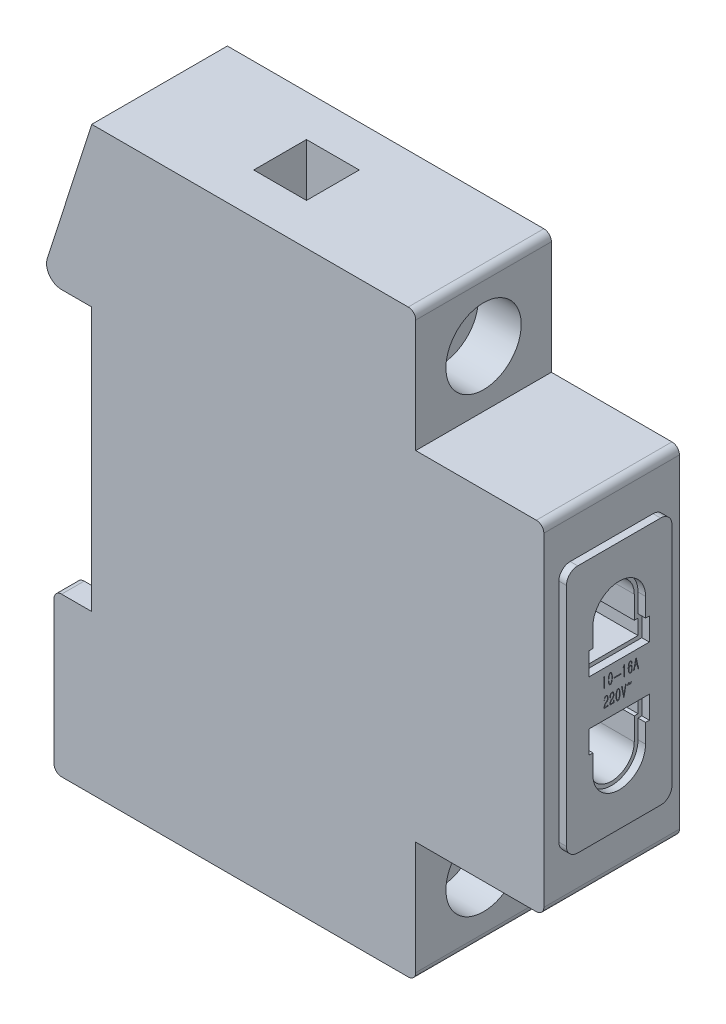
from build123d import *

# Parameters (mm, degrees)
EXTRUDE_1_DEPTH           = 9
EXTRUDE_2_DEPTH           = 1
CUT_EXTRUDE_1_DEPTH       = 1
CUT_EXTRUDE_2_DEPTH       = 10
HOLE_WIZARD_1_D           = 5.5
HOLE_WIZARD_1_DEPTH       = 7.5
HOLE_WIZARD_1_CBORE_D     = 10
HOLE_WIZARD_1_CBORE_DEPTH = 5.7
HOLE_WIZARD_1_TIP         = 1.652366702
CUT_EXTRUDE_3_REACH       = 103.814
SKETCH_6_W                = 8
SKETCH_6_H                = 12
SKETCH_7_R                = 3
SKETCH_7_W                = 5
SKETCH_7_H                = 7
SKETCH_7_H_2              = 8
CUT_EXTRUDE_4_DEPTH       = 10
SKETCH_8_W                = 7
SKETCH_8_H                = 7
CUT_EXTRUDE_5_DEPTH       = 10
SKETCH_9_W                = 7
SKETCH_9_H                = 7
CUT_EXTRUDE_6_DEPTH       = 10
SKETCH_1016A_W            = 0.927551673
SKETCH_1016A_H            = 0.093010868
CUT_EXTRUDE_7_DEPTH       = 0.25
CUT_EXTRUDE_8_DEPTH       = 0.25


with BuildPart() as part:
    # Sketch 221 → 凸台-拉伸1 (new, symmetric)
    with BuildSketch(Plane.XY):
        with BuildLine():
            Line((0, 1), (0, 20))
            ThreePointArc((0, 20), (0.292893219, 20.707106781), (1, 21))
            Line((1, 21), (5, 21))
            Line((5, 21), (5, 56))
            Line((5, 56), (1, 56))
            ThreePointArc((1, 56), (-0.615989127, 56.82162012), (-0.904249074, 58.611420858))
            Line((-0.904249074, 58.611420858), (5, 77))
            Line((5, 77), (47, 77))
            ThreePointArc((47, 77), (47.707106781, 76.707106781), (48, 76))
            Line((48, 76), (48, 61))
            Line((48, 61), (64, 61))
            ThreePointArc((64, 61), (64.707106781, 60.707106781), (65, 60))
            Line((65, 60), (65, 17))
            ThreePointArc((65, 17), (64.707106781, 16.292893219), (64, 16))
            Line((64, 16), (48, 16))
            Line((48, 16), (48, 1))
            ThreePointArc((48, 1), (47.707106781, 0.292893219), (47, 0))
            Line((47, 0), (1, 0))
            ThreePointArc((1, 0), (0.292893219, 0.292893219), (0, 1))
        make_face()
    extrude(amount=EXTRUDE_1_DEPTH, both=True)

    # 草图2 → 凸台-拉伸2 (add)
    with BuildSketch(Plane(origin=(65, 0, 0), x_dir=(0, 0, -1), z_dir=(1, 0, 0))):
        with BuildLine():
            Line((-5.5, 55), (5.5, 55))
            ThreePointArc((5.5, 55), (6.560660172, 54.560660172), (7, 53.5))
            Line((7, 53.5), (7, 23.5))
            ThreePointArc((7, 23.5), (6.560660172, 22.439339828), (5.5, 22))
            Line((5.5, 22), (-5.5, 22))
            ThreePointArc((-5.5, 22), (-6.560660172, 22.439339828), (-7, 23.5))
            Line((-7, 23.5), (-7, 53.5))
            ThreePointArc((-7, 53.5), (-6.560660172, 54.560660172), (-5.5, 55))
        make_face()
    extrude(amount=EXTRUDE_2_DEPTH)

    # 2P插孔 → 切除-拉伸1 (cut)
    with BuildSketch(Plane(origin=(66, 0, 0), x_dir=(0, 0, -1), z_dir=(1, 0, 0))):
        with BuildLine():
            Line((-3.5, 46.992069107), (-3.5, 44.492069107))
            Line((-3.5, 44.492069107), (-4, 44.492069107))
            Line((-4, 44.492069107), (-4, 41.492069107))
            Line((-4, 41.492069107), (4, 41.492069107))
            Line((4, 41.492069107), (4, 44.492069107))
            Line((4, 44.492069107), (3.5, 44.492069107))
            Line((3.5, 44.492069107), (3.5, 46.992069107))
            ThreePointArc((3.5, 46.992069107), (0, 50.492069107), (-3.5, 46.992069107))
        make_face()
        with BuildLine():
            Line((3.5, 32.507930893), (4, 32.507930893))
            Line((4, 32.507930893), (4, 35.507930893))
            Line((4, 35.507930893), (-4, 35.507930893))
            Line((-4, 35.507930893), (-4, 32.507930893))
            Line((-4, 32.507930893), (-3.5, 32.507930893))
            Line((-3.5, 32.507930893), (-3.5, 30.007930893))
            ThreePointArc((-3.5, 30.007930893), (0, 26.507930893), (3.5, 30.007930893))
            Line((3.5, 30.007930893), (3.5, 32.507930893))
        make_face()
    extrude(amount=-CUT_EXTRUDE_1_DEPTH, mode=Mode.SUBTRACT)

    # 2P插孔<3> → 切除-拉伸2 (cut)
    with BuildSketch(Plane(origin=(66, 0, 0), x_dir=(0, 0, -1), z_dir=(1, 0, 0))):
        with BuildLine():
            Line((-3, 46.992069107), (-3, 43.992069107))
            Line((-3, 43.992069107), (-3.5, 43.992069107))
            Line((-3.5, 43.992069107), (-3.5, 41.992069107))
            Line((-3.5, 41.992069107), (3.5, 41.992069107))
            Line((3.5, 41.992069107), (3.5, 43.992069107))
            Line((3.5, 43.992069107), (3, 43.992069107))
            Line((3, 43.992069107), (3, 46.992069107))
            ThreePointArc((3, 46.992069107), (0, 49.992069107), (-3, 46.992069107))
        make_face()
        with BuildLine():
            Line((3, 33.007930893), (3.5, 33.007930893))
            Line((3.5, 33.007930893), (3.5, 35.007930893))
            Line((3.5, 35.007930893), (-3.5, 35.007930893))
            Line((-3.5, 35.007930893), (-3.5, 33.007930893))
            Line((-3.5, 33.007930893), (-3, 33.007930893))
            Line((-3, 33.007930893), (-3, 30.007930893))
            ThreePointArc((-3, 30.007930893), (0, 27.007930893), (3, 30.007930893))
            Line((3, 30.007930893), (3, 33.007930893))
        make_face()
    extrude(amount=-CUT_EXTRUDE_2_DEPTH, mode=Mode.SUBTRACT)

    # 打孔尺寸(%根据)开槽圆柱头螺钉的类型1
    with Locations(Plane(origin=(48, 0, 0), x_dir=(0, 0, -1), z_dir=(1, 0, 0))):
        with Locations((0, 68.5), (0, 8.5)):
            CounterBoreHole(HOLE_WIZARD_1_D / 2, HOLE_WIZARD_1_CBORE_D / 2, HOLE_WIZARD_1_CBORE_DEPTH, depth=HOLE_WIZARD_1_DEPTH)
            with Locations((0, 0, -(HOLE_WIZARD_1_DEPTH + HOLE_WIZARD_1_TIP / 2))):  # 118° drill point
                Cone(0, HOLE_WIZARD_1_D / 2, HOLE_WIZARD_1_TIP, mode=Mode.SUBTRACT)

    # 切除-拉伸3: up to this face of the body (flat: up to its plane)
    cut_extrude_3_end = Plane(part.part.faces().sort_by_distance((3, 21, 0))[0])
    # 草图6 → 切除-拉伸3 (cut, up to the picked face)
    with BuildSketch(Plane.XZ, mode=Mode.PRIVATE) as cut_extrude_3_sk1:
        with Locations((1, 0)):
            Rectangle(SKETCH_6_W, SKETCH_6_H)
    cut_extrude_3_tool1 = split(extrude(cut_extrude_3_sk1.sketch, amount=-CUT_EXTRUDE_3_REACH, mode=Mode.PRIVATE), bisect_by=cut_extrude_3_end, keep=Keep.BOTH, mode=Mode.PRIVATE)
    add(cut_extrude_3_tool1.solids().sort_by(Axis((1, 0, 0), (0, 1, 0)))[0], mode=Mode.SUBTRACT)

    # 草图7 → 切除-拉伸4 (cut)
    with BuildSketch(Plane.ZY.offset(-5)):
        with Locations(Location((0, 38.5, 0), (0, 0, 270))):
            Circle(SKETCH_7_R)
        with Locations((0, 46)):
            Rectangle(SKETCH_7_W, SKETCH_7_H)
        with Locations((0, 30.5)):
            Rectangle(SKETCH_7_W, SKETCH_7_H_2)
    extrude(amount=-CUT_EXTRUDE_4_DEPTH, mode=Mode.SUBTRACT)

    # 草图8 → 切除-拉伸5 (cut)
    with BuildSketch(Plane(origin=(0, 77, 0), x_dir=(1, 0, 0), z_dir=(0, 1, 0))):
        with Locations((24.5, 0)):
            Rectangle(SKETCH_8_W, SKETCH_8_H)
    extrude(amount=-CUT_EXTRUDE_5_DEPTH, mode=Mode.SUBTRACT)

    # 草图9 → 切除-拉伸6 (cut)
    with BuildSketch(Plane.XZ):
        with Locations((24.5, 0)):
            Rectangle(SKETCH_9_W, SKETCH_9_H)
    extrude(amount=-CUT_EXTRUDE_6_DEPTH, mode=Mode.SUBTRACT)

    # 文字1016A → 切除-拉伸7 (cut)
    # profile 1 of 6: a face of its own
    with BuildSketch(Plane(origin=(66, 0, 0), x_dir=(0, 0, -1), z_dir=(1, 0, 0))):
        with BuildLine():
            Line((-1.957775378, 40.5744709), (-1.93412313, 40.5744709))
            Line((-1.93412313, 40.5744709), (-1.936360505, 39.428615371))
            add(Edge.make_bspline(
                [(-1.936360505, 39.428615371), (-1.936615384, 39.418281532), (-1.937104086, 39.398467548), (-1.937143748, 39.370118875), (-1.938076067, 39.344451781), (-1.938150326, 39.321429518), (-1.938843584, 39.301082161), (-1.93964527, 39.283405455), (-1.939721445, 39.268366262), (-1.941139484, 39.244827985), (-1.942829265, 39.21246461), (-1.947019834, 39.179130883), (-1.950355843, 39.155379208), (-1.95374717, 39.14456703), (-1.958043634, 39.136012081), (-1.962331497, 39.137009746), (-1.964167877, 39.13743702)],
                knots=[0, 0, 0, 0, 1.45038606, 2.780953852, 3.977268029, 5.053718292, 6.010937745, 6.833690271, 7.536464333, 8.120251454, 10.142880859, 12.069479857, 12.873132744, 13.440417135, 13.76034519, 14, 14, 14, 14], degree=3))
            add(Edge.make_bspline(
                [(-1.964167877, 39.13743702), (-1.96459239, 39.137758347), (-1.966409407, 39.139133704), (-1.97074249, 39.14204483), (-1.975891086, 39.149848276), (-1.97814482, 39.156849015), (-1.979509876, 39.161089268)],
                knots=[0, 0, 0, 0, 0.221265066, 0.947068446, 2.150880552, 4, 4, 4, 4], degree=3))
            Line((-1.979509876, 39.161089268), (-1.9900575, 39.189216266))
            Line((-1.9900575, 39.189216266), (-2.014029373, 39.266885134))
            add(Edge.make_bspline(
                [(-2.014029373, 39.266885134), (-2.01691507, 39.274192974), (-2.021941804, 39.286922855), (-2.027012669, 39.303670781), (-2.030859599, 39.314365039), (-2.031882082, 39.3230332), (-2.026956777, 39.331163958), (-2.023329459, 39.343682847), (-2.017747986, 39.359662385), (-2.012477164, 39.378522569), (-2.007821784, 39.398900701), (-2.003628099, 39.420918631), (-2.001251418, 39.445725517), (-2.000085563, 39.469410885), (-1.999190839, 39.492214928), (-1.999028281, 39.514168869), (-1.998579925, 39.540163008), (-1.998649967, 39.558915529), (-1.998687374, 39.568930734)],
                knots=[0, 0, 0, 0, 1.220359697, 2.125803599, 2.712350858, 2.994193817, 3.439826662, 4.12562012, 5.031064022, 6.063176816, 7.167225426, 8.277459231, 9.542238136, 11.034069985, 11.961482632, 13.08703073, 14.444263491, 16, 16, 16, 16], degree=3))
            Line((-1.998687374, 39.568930734), (-1.996769625, 40.414658413))
            Line((-1.996769625, 40.414658413), (-2.10895799, 40.317492421))
            Line((-2.10895799, 40.317492421), (-2.117587864, 40.354249293))
            add(Edge.make_bspline(
                [(-2.117587864, 40.354249293), (-2.108468534, 40.363672344), (-2.091373972, 40.381336242), (-2.068528059, 40.406769081), (-2.049738096, 40.428840756), (-2.030167095, 40.454643578), (-2.008255127, 40.48675503), (-1.99207383, 40.513137021), (-1.983665001, 40.526846779)],
                knots=[0, 0, 0, 0, 1.077185482, 2.019228619, 2.808185376, 3.45765616, 4.678836699, 6, 6, 6, 6], degree=3))
            Line((-1.983665001, 40.526846779), (-1.957775378, 40.5744709))
        make_face()
    # profile 2 of 6: a face of its own
    with BuildSketch(Plane(origin=(66, 0, 0), x_dir=(0, 0, -1), z_dir=(1, 0, 0))):
        with BuildLine():
            add(Edge.make_bspline(
                [(-1.443818421, 39.901340706), (-1.442776824, 39.922017987), (-1.440642789, 39.964381861), (-1.434841438, 40.029315671), (-1.426284257, 40.097056697), (-1.41636119, 40.166625401), (-1.402630338, 40.23534955), (-1.385057418, 40.300705646), (-1.362624183, 40.361133003), (-1.340239323, 40.407533474), (-1.321316181, 40.441553724), (-1.307547787, 40.464184813), (-1.294449079, 40.484594199), (-1.281543845, 40.50232618), (-1.268877316, 40.517425374), (-1.257195562, 40.530517655), (-1.24540608, 40.540710626), (-1.230620362, 40.550817891), (-1.212622957, 40.559832499), (-1.191767332, 40.567718641), (-1.17169966, 40.572280523), (-1.158626561, 40.572248819), (-1.152320445, 40.572233525)],
                knots=[0, 0, 0, 0, 1.583211401, 3.243703523, 4.983978234, 6.804605119, 8.6166428, 10.340282122, 11.974804003, 13.53820457, 14.274983449, 14.951299633, 15.563740824, 16.129235462, 16.626851747, 17.070813204, 17.469389546, 17.815167281, 18.438300608, 19.002855301, 19.519003895, 20, 20, 20, 20], degree=3))
            add(Edge.make_bspline(
                [(-1.152320445, 40.572233525), (-1.146290365, 40.571179096), (-1.133553898, 40.568951979), (-1.114724202, 40.560671122), (-1.094739192, 40.549658511), (-1.073476188, 40.53538519), (-1.052247101, 40.516193938), (-1.032572804, 40.490775678), (-1.014307672, 40.459732815), (-0.991609414, 40.410602698), (-0.966596702, 40.344010166), (-0.946956844, 40.274088965), (-0.934199405, 40.215708015), (-0.925879513, 40.169129451), (-0.919263868, 40.119737588), (-0.912159714, 40.050302233), (-0.905824114, 39.961327559), (-0.904803009, 39.889633305), (-0.904291466, 39.853716585)],
                knots=[0, 0, 0, 0, 0.36369769, 0.768186139, 1.217229854, 1.724510149, 2.290946358, 2.914777825, 3.632489608, 4.433551378, 6.137860108, 7.866765886, 8.757390638, 9.699141408, 10.686159515, 11.726895222, 13.859299765, 16, 16, 16, 16], degree=3))
            add(Edge.make_bspline(
                [(-0.904291466, 39.853716585), (-0.906248127, 39.824936911), (-0.910269473, 39.765788678), (-0.919836026, 39.67520078), (-0.935613892, 39.580961348), (-0.955468336, 39.501578219), (-0.974672524, 39.438372265), (-0.99095834, 39.392763441), (-1.00918037, 39.349692435), (-1.02862894, 39.309576657), (-1.04886152, 39.273866276), (-1.069805297, 39.243859214), (-1.091936524, 39.22074774), (-1.114673456, 39.204146754), (-1.136873151, 39.192896509), (-1.158084851, 39.185703259), (-1.178284829, 39.181710472), (-1.19140899, 39.182462752), (-1.197707191, 39.182823766)],
                knots=[0, 0, 0, 0, 1.760488992, 3.618172134, 5.557361062, 7.587083219, 8.607294374, 9.588398617, 10.541277716, 11.460251193, 12.307925722, 13.044175775, 13.687957546, 14.251129358, 14.754223989, 15.200440537, 15.616296545, 16, 16, 16, 16], degree=3))
            add(Edge.make_bspline(
                [(-1.197707191, 39.182823766), (-1.203725297, 39.183669704), (-1.216404983, 39.18545203), (-1.235517718, 39.192952267), (-1.255421101, 39.204508112), (-1.276669332, 39.219741092), (-1.298065126, 39.240668922), (-1.318668015, 39.267737628), (-1.338425909, 39.301094294), (-1.357202453, 39.340102578), (-1.374838207, 39.383551168), (-1.390280532, 39.430432866), (-1.40458754, 39.47969773), (-1.416051307, 39.531206735), (-1.425484774, 39.583264884), (-1.432886447, 39.634435682), (-1.438079905, 39.684120497), (-1.440882679, 39.732121162), (-1.441862736, 39.778070749), (-1.442898516, 39.821537976), (-1.443546489, 39.862344751), (-1.443730008, 39.888662078), (-1.443818421, 39.901340706)],
                knots=[0, 0, 0, 0, 0.451175502, 0.950591959, 1.515271951, 2.162531354, 2.891688268, 3.734081857, 4.687580886, 5.773002708, 6.954198864, 8.17563603, 9.445923076, 10.771603705, 12.101713585, 13.383756751, 14.619631726, 15.819374781, 16.961914306, 18.040825747, 19.056148764, 20, 20, 20, 20], degree=3))
        make_face()
        with BuildLine():
            add(Edge.make_bspline(
                [(-1.387564425, 39.896865957), (-1.387791887, 39.886531892), (-1.388274908, 39.864587302), (-1.388734275, 39.829635981), (-1.387877294, 39.790744587), (-1.386412995, 39.733354351), (-1.381036988, 39.658352514), (-1.367296895, 39.56830935), (-1.347673413, 39.481109699), (-1.326050109, 39.412778577), (-1.305918979, 39.364067913), (-1.290471211, 39.333836319), (-1.2742196, 39.309413314), (-1.257192836, 39.290810113), (-1.23996984, 39.27762632), (-1.223874314, 39.268205463), (-1.208621801, 39.261736405), (-1.198399808, 39.26089274), (-1.193552066, 39.260492635)],
                knots=[0, 0, 0, 0, 0.705717407, 1.498604912, 2.386138873, 3.361274458, 5.418191474, 7.514713171, 9.57394393, 11.515405308, 12.398906158, 13.169972934, 13.829695216, 14.395845116, 14.883250105, 15.303691084, 15.669778158, 16, 16, 16, 16], degree=3))
            add(Edge.make_bspline(
                [(-1.193552066, 39.260492635), (-1.189064147, 39.260550358), (-1.179424155, 39.260674346), (-1.164341937, 39.26430136), (-1.148486091, 39.271936345), (-1.130898397, 39.281969382), (-1.112830148, 39.297410495), (-1.094996464, 39.318512538), (-1.077516764, 39.34555724), (-1.060084034, 39.377536742), (-1.043593937, 39.413115804), (-1.028822279, 39.450810558), (-1.015966979, 39.489722069), (-1.002063862, 39.544161905), (-0.987770787, 39.614768269), (-0.97493234, 39.700990174), (-0.966418312, 39.786017292), (-0.962872667, 39.855383159), (-0.961886404, 39.910290221), (-0.962706046, 39.953982993), (-0.964252486, 40.000869948), (-0.966023175, 40.033242033), (-0.96693796, 40.049966319)],
                knots=[0, 0, 0, 0, 0.308126263, 0.661851094, 1.055455993, 1.515432549, 2.051181639, 2.679899785, 3.409545513, 4.262246801, 5.183512362, 6.104777924, 7.045624675, 8.000099589, 9.967578284, 11.997814557, 13.993544283, 15.842664909, 16.77344086, 17.770161498, 18.848005724, 20, 20, 20, 20], degree=3))
            add(Edge.make_bspline(
                [(-0.96693796, 40.049966319), (-0.968479455, 40.065633571), (-0.971471474, 40.096043483), (-0.976731669, 40.139992941), (-0.983259002, 40.180782156), (-0.992456493, 40.231033616), (-1.007303655, 40.291330324), (-1.027754572, 40.348734611), (-1.045393249, 40.392075392), (-1.060554195, 40.419535868), (-1.075974074, 40.44284021), (-1.093109438, 40.46062436), (-1.109788763, 40.474482895), (-1.12548712, 40.484840805), (-1.140149441, 40.492153986), (-1.150022956, 40.493805927), (-1.15455782, 40.494564657)],
                knots=[0, 0, 0, 0, 1.302834758, 2.528783491, 3.662347304, 4.720685654, 6.75648594, 8.792057095, 9.759925264, 10.624039914, 11.384659521, 12.06448684, 12.659424566, 13.175428451, 13.621277708, 14, 14, 14, 14], degree=3))
            add(Edge.make_bspline(
                [(-1.15455782, 40.494564657), (-1.15948745, 40.494205933), (-1.169846357, 40.493452128), (-1.185660167, 40.488604913), (-1.202444575, 40.48102547), (-1.220884564, 40.470511897), (-1.240093756, 40.453637742), (-1.259489911, 40.428937467), (-1.279559882, 40.39617419), (-1.300507559, 40.35584263), (-1.320522514, 40.308324061), (-1.337527814, 40.253895813), (-1.352222634, 40.193478666), (-1.363291134, 40.128776017), (-1.372232264, 40.06401917), (-1.379203843, 40.003151213), (-1.384544736, 39.948069221), (-1.386596374, 39.913280691), (-1.387564425, 39.896865957)],
                knots=[0, 0, 0, 0, 0.347392606, 0.729995465, 1.156884588, 1.644891073, 2.219813456, 2.945627096, 3.849684979, 4.924243867, 6.145708801, 7.477723151, 8.938118981, 10.524254447, 12.100980159, 13.544449593, 14.841364989, 16, 16, 16, 16], degree=3))
        make_face(mode=Mode.SUBTRACT)
    # profile 3 of 6: a face of its own
    with BuildSketch(Plane(origin=(66, 0, 0), x_dir=(0, 0, -1), z_dir=(1, 0, 0))):
        with Locations((-0.24778177, 39.716757284)):
            Rectangle(SKETCH_1016A_W, SKETCH_1016A_H)
    # profile 4 of 6: a face of its own
    with BuildSketch(Plane(origin=(66, 0, 0), x_dir=(0, 0, -1), z_dir=(1, 0, 0))):
        with BuildLine():
            Line((0.681048402, 40.5744709), (0.70470065, 40.5744709))
            Line((0.70470065, 40.5744709), (0.702463276, 39.428615371))
            add(Edge.make_bspline(
                [(0.702463276, 39.428615371), (0.702208397, 39.418281532), (0.701719695, 39.398467548), (0.701680032, 39.370118875), (0.700747713, 39.344451781), (0.700673454, 39.321429518), (0.699980196, 39.301082161), (0.69917851, 39.283405455), (0.699102335, 39.268366262), (0.697684296, 39.244827985), (0.695994515, 39.21246461), (0.691803946, 39.179130883), (0.688467937, 39.155379208), (0.68507661, 39.14456703), (0.680780146, 39.136012081), (0.676492283, 39.137009746), (0.674655903, 39.13743702)],
                knots=[0, 0, 0, 0, 1.45038606, 2.780953852, 3.977268029, 5.053718292, 6.010937745, 6.833690271, 7.536464333, 8.120251454, 10.142880859, 12.069479857, 12.873132744, 13.440417135, 13.76034519, 14, 14, 14, 14], degree=3))
            add(Edge.make_bspline(
                [(0.674655903, 39.13743702), (0.67423139, 39.137758347), (0.672414373, 39.139133704), (0.66808129, 39.14204483), (0.662932694, 39.149848276), (0.66067896, 39.156849015), (0.659313904, 39.161089268)],
                knots=[0, 0, 0, 0, 0.221265066, 0.947068446, 2.150880552, 4, 4, 4, 4], degree=3))
            Line((0.659313904, 39.161089268), (0.64876628, 39.189216266))
            Line((0.64876628, 39.189216266), (0.624794407, 39.266885134))
            add(Edge.make_bspline(
                [(0.624794407, 39.266885134), (0.621908711, 39.274192974), (0.616881976, 39.286922855), (0.611811111, 39.303670781), (0.607964181, 39.314365039), (0.606941698, 39.3230332), (0.611867003, 39.331163958), (0.615494321, 39.343682847), (0.621075794, 39.359662385), (0.626346616, 39.378522569), (0.631001996, 39.398900701), (0.635195681, 39.420918631), (0.637572362, 39.445725517), (0.638738217, 39.469410885), (0.639632941, 39.492214928), (0.639795499, 39.514168869), (0.640243855, 39.540163008), (0.640173813, 39.558915529), (0.640136406, 39.568930734)],
                knots=[0, 0, 0, 0, 1.220359697, 2.125803599, 2.712350858, 2.994193817, 3.439826662, 4.12562012, 5.031064022, 6.063176816, 7.167225426, 8.277459231, 9.542238136, 11.034069985, 11.961482632, 13.08703073, 14.444263491, 16, 16, 16, 16], degree=3))
            Line((0.640136406, 39.568930734), (0.642054156, 40.414658413))
            Line((0.642054156, 40.414658413), (0.52986579, 40.317492421))
            Line((0.52986579, 40.317492421), (0.521235916, 40.354249293))
            add(Edge.make_bspline(
                [(0.521235916, 40.354249293), (0.530355247, 40.363672344), (0.547449808, 40.381336242), (0.570295721, 40.406769081), (0.589085684, 40.428840756), (0.608656685, 40.454643578), (0.630568653, 40.48675503), (0.64674995, 40.513137021), (0.655158779, 40.526846779)],
                knots=[0, 0, 0, 0, 1.077185482, 2.019228619, 2.808185376, 3.45765616, 4.678836699, 6, 6, 6, 6], degree=3))
            Line((0.655158779, 40.526846779), (0.681048402, 40.5744709))
        make_face()
    # profile 5 of 6: a face of its own
    with BuildSketch(Plane(origin=(66, 0, 0), x_dir=(0, 0, -1), z_dir=(1, 0, 0))):
        with BuildLine():
            Line((1.704167942, 40.164392059), (1.674123195, 40.164392059))
            add(Edge.make_bspline(
                [(1.674123195, 40.164392059), (1.672069661, 40.177266363), (1.668006635, 40.202738867), (1.66426445, 40.241663294), (1.659700671, 40.282109433), (1.651886667, 40.324905069), (1.639592271, 40.369397915), (1.622299198, 40.404769152), (1.605939935, 40.43127281), (1.59199346, 40.44899653), (1.57599338, 40.463842832), (1.558891993, 40.476341326), (1.540476048, 40.486004368), (1.521168623, 40.492977042), (1.500678069, 40.496096551), (1.479822274, 40.495900047), (1.459515853, 40.493535065), (1.440653876, 40.488616988), (1.423646317, 40.481959318), (1.407859015, 40.473143592), (1.393372733, 40.460395406), (1.378262616, 40.44441976), (1.363104792, 40.423595263), (1.347238887, 40.398998548), (1.331861945, 40.370269136), (1.318295385, 40.337565566), (1.306180619, 40.301344824), (1.292111289, 40.247817132), (1.279065299, 40.175944328), (1.271241179, 40.102410436), (1.267541795, 40.044657804), (1.265705811, 40.005972526), (1.264200412, 39.972415641), (1.26409342, 39.951736244), (1.264044354, 39.942252703)],
                knots=[0, 0, 0, 0, 1.172618578, 2.320089015, 3.517365984, 4.833421129, 6.231766425, 7.655217032, 8.357323983, 9.032478261, 9.676711985, 10.315215253, 10.932648665, 11.54199308, 12.153444918, 12.786093219, 13.413857257, 13.988112725, 14.53457488, 15.054145165, 15.605211832, 16.262994999, 17.029841423, 17.917944275, 18.895673466, 19.956732694, 21.09950916, 22.329492637, 24.933332206, 27.662278065, 28.97833321, 30.139613505, 31.146829503, 32, 32, 32, 32], degree=3))
            Line((1.264044354, 39.942252703), (1.262126604, 39.858191335))
            add(Edge.make_bspline(
                [(1.262126604, 39.858191335), (1.267462069, 39.873246384), (1.277105992, 39.900458581), (1.291913206, 39.93800282), (1.308679679, 39.969838627), (1.328225141, 39.999277015), (1.353518404, 40.0264472), (1.379356854, 40.046297988), (1.40365283, 40.060018988), (1.425228477, 40.067882531), (1.449521165, 40.073314489), (1.46665907, 40.074982316), (1.475636086, 40.075855942)],
                knots=[0, 0, 0, 0, 1.463710204, 2.645675197, 3.693667506, 4.755032446, 5.874045908, 7.078730407, 7.725382873, 8.423483439, 9.174203962, 10, 10, 10, 10], degree=3))
            add(Edge.make_bspline(
                [(1.475636086, 40.075855942), (1.488605193, 40.075360018), (1.513268855, 40.074416909), (1.548775572, 40.063801723), (1.581968965, 40.045174559), (1.607537731, 40.022398591), (1.628178509, 39.99992139), (1.643381698, 39.979338762), (1.658217317, 39.9560569), (1.677286759, 39.921170375), (1.697849906, 39.873592908), (1.712707954, 39.822753334), (1.720425902, 39.779678003), (1.725458468, 39.744957078), (1.728123501, 39.707901386), (1.729676401, 39.656096528), (1.728915307, 39.591437455), (1.725389367, 39.540046166), (1.723665065, 39.514914113)],
                knots=[0, 0, 0, 0, 0.909148716, 1.728949998, 2.576991438, 3.564625719, 4.121218537, 4.72026629, 5.360049571, 6.060456872, 7.512703724, 8.993852322, 9.770776208, 10.587253518, 11.458483217, 12.380006039, 14.229702395, 16, 16, 16, 16], degree=3))
            add(Edge.make_bspline(
                [(1.723665065, 39.514914113), (1.72165076, 39.50189521), (1.717473134, 39.474894293), (1.708621092, 39.433242844), (1.697762349, 39.389000963), (1.685287268, 39.343790868), (1.670842764, 39.300863894), (1.651732846, 39.264281965), (1.628621278, 39.235562666), (1.601917209, 39.215763125), (1.575544349, 39.202716071), (1.551957622, 39.1926157), (1.531427085, 39.185326493), (1.518293797, 39.183599646), (1.512392958, 39.182823766)],
                knots=[0, 0, 0, 0, 1.110217054, 2.302565578, 3.587623031, 4.949459538, 6.256081064, 7.397105523, 8.411240029, 9.334418742, 10.173869837, 10.886090718, 11.499516107, 12, 12, 12, 12], degree=3))
            add(Edge.make_bspline(
                [(1.512392958, 39.182823766), (1.501624622, 39.181921022), (1.480155087, 39.180121163), (1.453039243, 39.185046819), (1.431294324, 39.192638017), (1.4136728, 39.201710077), (1.394089595, 39.21270009), (1.373685132, 39.227051222), (1.352953646, 39.243743824), (1.334402608, 39.264366855), (1.317307877, 39.287389672), (1.297598273, 39.322227371), (1.276869141, 39.368452007), (1.257637362, 39.4164459), (1.245257385, 39.458912726), (1.23686342, 39.496948741), (1.228925612, 39.541098478), (1.222068245, 39.589223305), (1.21601826, 39.636774375), (1.210961101, 39.679411341), (1.206683787, 39.714864401), (1.202792175, 39.752546166), (1.200077342, 39.794434164), (1.199199772, 39.843807639), (1.200040049, 39.895809961), (1.201136653, 39.931813059), (1.201717484, 39.950882577)],
                knots=[0, 0, 0, 0, 0.848219995, 1.691151707, 2.144998995, 2.659153853, 3.249319417, 3.912736756, 4.621867519, 5.340468245, 6.090710837, 6.87657341, 8.487178015, 10.078339935, 10.944022033, 11.968008362, 13.14490399, 14.476453821, 15.796264219, 16.920399402, 17.85823784, 18.608902694, 19.903936842, 21.162934464, 22.497310667, 24, 24, 24, 24], degree=3))
            add(Edge.make_bspline(
                [(1.201717484, 39.950882577), (1.202102078, 39.966119514), (1.202825678, 39.994787316), (1.204463317, 40.035060237), (1.20615495, 40.069823187), (1.209774529, 40.109702532), (1.215737912, 40.158566128), (1.22514118, 40.218361536), (1.236173579, 40.278346531), (1.24820063, 40.326581022), (1.259773822, 40.363497759), (1.27065181, 40.391736785), (1.284323891, 40.420653115), (1.299176824, 40.450415618), (1.316138396, 40.478689853), (1.334816294, 40.504113807), (1.354976697, 40.525579239), (1.376557259, 40.543750506), (1.400916715, 40.557478708), (1.428101375, 40.567179759), (1.458507671, 40.572205731), (1.479668071, 40.572224024), (1.49065846, 40.572233525)],
                knots=[0, 0, 0, 0, 1.211628523, 2.279639787, 3.204225299, 3.977932759, 5.462339825, 7.116605252, 8.789327199, 10.30942825, 11.064792467, 11.863814246, 12.712679163, 13.606614715, 14.50718602, 15.330439464, 16.109367713, 16.843542067, 17.564206182, 18.319665359, 19.127259812, 20, 20, 20, 20], degree=3))
            add(Edge.make_bspline(
                [(1.49065846, 40.572233525), (1.501797544, 40.571311394), (1.522847321, 40.569568821), (1.551861559, 40.561668332), (1.576784756, 40.551177701), (1.596515346, 40.536306914), (1.611999344, 40.519908361), (1.626307446, 40.505013103), (1.637561968, 40.489919586), (1.64735071, 40.475114096), (1.655445976, 40.458675839), (1.663554672, 40.440086681), (1.671055059, 40.418210288), (1.678346208, 40.394285855), (1.685152218, 40.370196468), (1.690948824, 40.347826308), (1.695436327, 40.328107345), (1.699978449, 40.304320659), (1.703743245, 40.273075502), (1.704018273, 40.247402332), (1.704167942, 40.233431053)],
                knots=[0, 0, 0, 0, 1.358046768, 2.566331314, 3.646368544, 4.629682629, 5.546946845, 6.391627168, 7.141431054, 7.835891544, 8.549473584, 9.368770778, 10.304200405, 11.362836174, 12.414134618, 13.351720444, 14.176238426, 14.875889185, 16.299866179, 18, 18, 18, 18], degree=3))
            Line((1.704167942, 40.233431053), (1.704167942, 40.164392059))
        make_face()
        with BuildLine():
            add(Edge.make_bspline(
                [(1.289933977, 39.631577229), (1.290580218, 39.612378033), (1.291906516, 39.572975064), (1.29996558, 39.513214634), (1.313977721, 39.452584927), (1.330722283, 39.402903112), (1.347332839, 39.364930188), (1.362254937, 39.339285305), (1.378433119, 39.315918083), (1.396935525, 39.295852553), (1.417282504, 39.278812707), (1.440795254, 39.268081598), (1.466251291, 39.26175832), (1.48380288, 39.262398402), (1.492895835, 39.262730009)],
                knots=[0, 0, 0, 0, 1.4886747, 3.055242853, 4.666194597, 6.306608966, 7.112592917, 7.87485258, 8.603662743, 9.310999056, 9.986965693, 10.644668568, 11.297843225, 12, 12, 12, 12], degree=3))
            add(Edge.make_bspline(
                [(1.492895835, 39.262730009), (1.500737664, 39.263473327), (1.516455193, 39.264963171), (1.539279744, 39.273168348), (1.561224364, 39.285443392), (1.581819001, 39.302209391), (1.600528206, 39.322014688), (1.617179956, 39.343965392), (1.630637106, 39.36809957), (1.644701884, 39.403588905), (1.657676536, 39.452237433), (1.664813103, 39.514973282), (1.669206564, 39.580605067), (1.672594482, 39.648237953), (1.671827194, 39.718337563), (1.663415058, 39.765146152), (1.659100821, 39.789152341)],
                knots=[0, 0, 0, 0, 0.542441635, 1.087226227, 1.660703064, 2.273516638, 2.914006631, 3.539772715, 4.172601069, 4.816509057, 6.173746714, 7.636628278, 9.17189136, 10.71932084, 12.317475397, 14, 14, 14, 14], degree=3))
            add(Edge.make_bspline(
                [(1.659100821, 39.789152341), (1.653244337, 39.808840941), (1.64160758, 39.847961933), (1.619397217, 39.893471894), (1.598789861, 39.925974261), (1.583557331, 39.947172415), (1.566544111, 39.963509238), (1.549620362, 39.97668289), (1.531933861, 39.985882321), (1.514391414, 39.993026794), (1.496096756, 39.996114657), (1.483953195, 39.996217723), (1.477873461, 39.996269323)],
                knots=[0, 0, 0, 0, 2.076888393, 4.126750173, 5.096135134, 5.973977047, 6.759453719, 7.47553224, 8.136547057, 8.771446398, 9.384918551, 10, 10, 10, 10], degree=3))
            add(Edge.make_bspline(
                [(1.477873461, 39.996269323), (1.470466049, 39.99512333), (1.455550491, 39.99281576), (1.434060853, 39.984941981), (1.413462825, 39.973504049), (1.388506822, 39.953697001), (1.361185844, 39.92598371), (1.340064284, 39.894005467), (1.327627273, 39.865853979), (1.318717583, 39.841772277), (1.310833597, 39.813951293), (1.303509569, 39.782949028), (1.297500384, 39.748808638), (1.293001778, 39.712010864), (1.2905366, 39.67262951), (1.290138904, 39.645537415), (1.289933977, 39.631577229)],
                knots=[0, 0, 0, 0, 0.703513377, 1.416593983, 2.138698186, 2.910269809, 4.405335412, 5.780974721, 6.484987373, 7.296510348, 8.193863016, 9.202460595, 10.29132512, 11.452082192, 12.687092747, 14, 14, 14, 14], degree=3))
        make_face(mode=Mode.SUBTRACT)
    # profile 6 of 6: a face of its own
    with BuildSketch(Plane(origin=(66, 0, 0), x_dir=(0, 0, -1), z_dir=(1, 0, 0))):
        with BuildLine():
            Line((2.376019636, 39.756550593), (2.082603911, 39.685593849))
            Line((2.082603911, 39.685593849), (2.013564916, 39.364051126))
            Line((2.013564916, 39.364051126), (1.980963169, 39.200083515))
            Line((1.980963169, 39.200083515), (1.96817817, 39.148304269))
            add(Edge.make_bspline(
                [(1.96817817, 39.148304269), (1.966820572, 39.144636519), (1.96453111, 39.138451201), (1.960223225, 39.131174111), (1.955495868, 39.127557774), (1.950217719, 39.126795435), (1.946257974, 39.131372233), (1.943903329, 39.137172504), (1.943198537, 39.145684482), (1.941240102, 39.156766762), (1.940015351, 39.172620315), (1.938610008, 39.184642405), (1.937813798, 39.19145364)],
                knots=[0, 0, 0, 0, 1.226577759, 2.068508672, 2.595953142, 3.064162245, 3.560072257, 4.322224954, 5.029865969, 6.20926766, 7.852322798, 10, 10, 10, 10], degree=3))
            Line((1.937813798, 39.19145364), (1.927266173, 39.281907508))
            add(Edge.make_bspline(
                [(1.927266173, 39.281907508), (1.926584386, 39.289361298), (1.925368071, 39.302658914), (1.92429936, 39.32025225), (1.924229969, 39.33294565), (1.924845061, 39.343564872), (1.927989637, 39.353607212), (1.931725374, 39.36048946), (1.933658673, 39.364051126)],
                knots=[0, 0, 0, 0, 1.603576797, 2.86079302, 3.773774944, 4.323462854, 5.1323669, 6, 6, 6, 6], degree=3))
            Line((1.933658673, 39.364051126), (1.944525922, 39.383548249))
            add(Edge.make_bspline(
                [(1.944525922, 39.383548249), (1.946853395, 39.388626326), (1.952411899, 39.400753865), (1.959450016, 39.423079982), (1.966948377, 39.452148934), (1.974504053, 39.485606781), (1.981910325, 39.518007819), (1.987827043, 39.544408573), (1.992368246, 39.561920786), (1.995321696, 39.570536521), (1.996305168, 39.573405483)],
                knots=[0, 0, 0, 0, 0.679694972, 1.623257572, 2.844174753, 4.335796169, 5.799225578, 6.891200865, 7.630779852, 8, 8, 8, 8], degree=3))
            Line((1.996305168, 39.573405483), (2.218444524, 40.602278273))
            Line((2.218444524, 40.602278273), (2.248489272, 40.602278273))
            Line((2.248489272, 40.602278273), (2.457843629, 39.676963975))
            Line((2.457843629, 39.676963975), (2.483733252, 39.568930734))
            add(Edge.make_bspline(
                [(2.483733252, 39.568930734), (2.486330223, 39.556769441), (2.490988807, 39.534953864), (2.498077849, 39.505981825), (2.503891832, 39.484286004), (2.507980024, 39.472390041), (2.509622875, 39.467609617)],
                knots=[0, 0, 0, 0, 1.425899692, 2.557855139, 3.420470246, 4, 4, 4, 4], degree=3))
            Line((2.509622875, 39.467609617), (2.524645249, 39.426697621))
            add(Edge.make_bspline(
                [(2.524645249, 39.426697621), (2.526374434, 39.420704601), (2.529524943, 39.409785551), (2.534906661, 39.395334326), (2.540195682, 39.384176003), (2.546929916, 39.37477838), (2.553760785, 39.36772511), (2.558475814, 39.360410543), (2.559071478, 39.353582183), (2.558245593, 39.347322267), (2.557363618, 39.33934952), (2.556934471, 39.329310577), (2.555795207, 39.3154792), (2.555291947, 39.305029473), (2.555009621, 39.299167256)],
                knots=[0, 0, 0, 0, 1.645080438, 2.997272953, 4.065812928, 4.892545225, 6.029861332, 6.67147811, 7.124734071, 7.80170629, 8.338742145, 9.240009017, 10.451666043, 12, 12, 12, 12], degree=3))
            Line((2.555009621, 39.299167256), (2.546379747, 39.202320889))
            Line((2.546379747, 39.202320889), (2.541904997, 39.165564017))
            add(Edge.make_bspline(
                [(2.541904997, 39.165564017), (2.541692244, 39.161395558), (2.541314066, 39.153985937), (2.539490912, 39.144441457), (2.538297286, 39.137513336), (2.535782597, 39.132501064), (2.531004908, 39.130022652), (2.525081916, 39.131751338), (2.520529577, 39.137742294), (2.519091341, 39.143000812), (2.518252749, 39.146066894)],
                knots=[0, 0, 0, 0, 1.663187075, 2.956388731, 3.874273883, 4.464983498, 5.130530035, 5.83179128, 6.735783313, 8, 8, 8, 8], degree=3))
            Line((2.518252749, 39.146066894), (2.503230375, 39.232365637))
            Line((2.503230375, 39.232365637), (2.376019636, 39.756550593))
        make_face()
        with BuildLine():
            Line((2.371544886, 39.789152341), (2.233466898, 40.39516129))
            Line((2.233466898, 40.39516129), (2.093151535, 39.761025343))
            add(Edge.make_bspline(
                [(2.093151535, 39.761025343), (2.105323811, 39.762901541), (2.126338083, 39.766140618), (2.155627342, 39.772573377), (2.183347701, 39.780187764), (2.207963563, 39.786998793), (2.228296634, 39.793908462), (2.241581945, 39.798480509), (2.251674881, 39.803204701), (2.257043227, 39.806786425), (2.259356521, 39.808329839)],
                knots=[0, 0, 0, 0, 1.70172219, 2.937860729, 4.141475294, 5.674569601, 6.46612829, 7.108957565, 7.616037637, 8, 8, 8, 8], degree=3))
            Line((2.259356521, 39.808329839), (2.313373141, 39.845086711))
            Line((2.313373141, 39.845086711), (2.371544886, 39.789152341))
        make_face(mode=Mode.SUBTRACT)
    extrude(amount=-CUT_EXTRUDE_7_DEPTH, mode=Mode.SUBTRACT)

    # 文字220V → 切除-拉伸8 (cut)
    # profile 1 of 5: a face of its own
    with BuildSketch(Plane(origin=(66, 0, 0), x_dir=(0, 0, -1), z_dir=(1, 0, 0))):
        with BuildLine():
            Line((-1.946495457, 37.670122236), (-1.979097204, 37.670122236))
            add(Edge.make_bspline(
                [(-1.979097204, 37.670122236), (-1.979768948, 37.680454774), (-1.981049576, 37.70015294), (-1.982371009, 37.728284057), (-1.982929057, 37.753542362), (-1.983488093, 37.784335194), (-1.982625919, 37.823168849), (-1.98031091, 37.854447855), (-1.979097204, 37.87084672)],
                knots=[0, 0, 0, 0, 0.927540379, 1.768282303, 2.522502339, 3.190652681, 4.527123766, 6, 6, 6, 6], degree=3))
            add(Edge.make_bspline(
                [(-1.979097204, 37.87084672), (-1.978257244, 37.883003696), (-1.976632857, 37.906513894), (-1.972345855, 37.940397825), (-1.967384495, 37.971796843), (-1.960934257, 38.001329938), (-1.952218923, 38.030231021), (-1.939811702, 38.05930053), (-1.924337559, 38.089534129), (-1.906055271, 38.119873535), (-1.885995284, 38.148501199), (-1.86347878, 38.171797162), (-1.839913429, 38.18955339), (-1.814840454, 38.200121051), (-1.790766766, 38.206692628), (-1.768813535, 38.211861875), (-1.749085716, 38.215474479), (-1.736621688, 38.215860022), (-1.7307486, 38.216041691)],
                knots=[0, 0, 0, 0, 1.238521709, 2.395159043, 3.470603583, 4.46912877, 5.466066804, 6.534123646, 7.677244524, 8.916145015, 10.13365226, 11.221244199, 12.198275335, 13.109907183, 13.966820176, 14.733954848, 15.403435577, 16, 16, 16, 16], degree=3))
            add(Edge.make_bspline(
                [(-1.7307486, 38.216041691), (-1.723263944, 38.215489827), (-1.708474497, 38.214399362), (-1.68671963, 38.209346935), (-1.665708894, 38.202062091), (-1.638835454, 38.189084939), (-1.60741129, 38.168738555), (-1.580677699, 38.142020382), (-1.562178814, 38.117563389), (-1.549148163, 38.096748597), (-1.537600949, 38.073505988), (-1.523099762, 38.039733685), (-1.507929504, 37.994917533), (-1.496989489, 37.938314422), (-1.489975021, 37.87953461), (-1.486765679, 37.819443941), (-1.486168936, 37.759945534), (-1.489662536, 37.721141638), (-1.491349494, 37.702404359)],
                knots=[0, 0, 0, 0, 0.570779476, 1.127842599, 1.694919432, 2.261066821, 3.397481896, 4.527710891, 5.118384485, 5.730727279, 6.394748858, 7.092559246, 8.529363642, 9.986910621, 11.474321506, 13.03467297, 14.568129345, 16, 16, 16, 16], degree=3))
            add(Edge.make_bspline(
                [(-1.491349494, 37.702404359), (-1.494769226, 37.683130538), (-1.501659713, 37.644295329), (-1.516501007, 37.597538272), (-1.530342197, 37.561990859), (-1.541914157, 37.538170472), (-1.554278683, 37.517082791), (-1.572157713, 37.49214452), (-1.599461327, 37.463836794), (-1.624762581, 37.444853305), (-1.638057357, 37.434878256)],
                knots=[0, 0, 0, 0, 1.490916612, 3.004077927, 3.729534125, 4.397912905, 5.020560084, 5.590839424, 6.734084393, 8, 8, 8, 8], degree=3))
            Line((-1.638057357, 37.434878256), (-1.743853223, 37.368076637))
            add(Edge.make_bspline(
                [(-1.743853223, 37.368076637), (-1.757334797, 37.358924166), (-1.782898432, 37.341569335), (-1.817032943, 37.313221035), (-1.845683158, 37.283351285), (-1.867338484, 37.250324178), (-1.884157732, 37.216327407), (-1.899092689, 37.182191326), (-1.910367822, 37.144565507), (-1.918387135, 37.110840427), (-1.923856041, 37.082516433), (-1.926595526, 37.062762675), (-1.928820986, 37.045304063), (-1.929103249, 37.034393997), (-1.929235708, 37.029274165)],
                knots=[0, 0, 0, 0, 1.453572249, 2.75625039, 3.953730064, 5.132566341, 6.263730064, 7.337486329, 8.453238547, 9.76321854, 10.430854957, 11.026567013, 11.543191201, 12, 12, 12, 12], degree=3))
            Line((-1.929235708, 37.029274165), (-1.933710458, 36.938820297))
            Line((-1.933710458, 36.938820297), (-1.54760349, 36.951605296))
            add(Edge.make_bspline(
                [(-1.54760349, 36.951605296), (-1.542649085, 36.95188231), (-1.533947182, 36.952368855), (-1.525584118, 36.961486021), (-1.523722597, 36.972618087), (-1.520419444, 36.986310208), (-1.517963775, 37.005936641), (-1.516069399, 37.020862221), (-1.515001742, 37.029274165)],
                knots=[0, 0, 0, 0, 0.925905201, 1.626257371, 2.181371879, 3.087088273, 4.358305093, 6, 6, 6, 6], degree=3))
            Line((-1.515001742, 37.029274165), (-1.506371868, 37.217213649))
            Line((-1.506371868, 37.217213649), (-1.476327121, 37.217213649))
            Line((-1.476327121, 37.217213649), (-1.465459872, 36.932427798))
            add(Edge.make_bspline(
                [(-1.465459872, 36.932427798), (-1.465096574, 36.926891251), (-1.464461165, 36.917207824), (-1.464151857, 36.904398049), (-1.464143102, 36.895478397), (-1.464278003, 36.888276682), (-1.466597513, 36.881980088), (-1.468752804, 36.874673965), (-1.477160393, 36.87054635), (-1.489245706, 36.869225695), (-1.507612694, 36.867355291), (-1.522028057, 36.867474919), (-1.530343741, 36.867543928)],
                knots=[0, 0, 0, 0, 1.385018147, 2.4223982, 3.193529914, 3.619812046, 4.200562765, 4.878496499, 5.402948042, 6.404258339, 7.925751149, 10, 10, 10, 10], degree=3))
            Line((-1.530343741, 36.867543928), (-1.95960008, 36.856676679))
            add(Edge.make_bspline(
                [(-1.95960008, 36.856676679), (-1.964818126, 36.856661414), (-1.975103279, 36.856631325), (-1.985643133, 36.866858743), (-1.990067547, 36.87937909), (-1.992281948, 36.894105531), (-1.993765207, 36.913642642), (-1.994477673, 36.947245273), (-1.992954443, 36.995056653), (-1.989523412, 37.034508549), (-1.987727078, 37.055163788)],
                knots=[0, 0, 0, 0, 0.556373901, 1.096654043, 1.476064089, 2.012759395, 2.73145082, 3.635924119, 5.715166189, 8, 8, 8, 8], degree=3))
            add(Edge.make_bspline(
                [(-1.987727078, 37.055163788), (-1.986132981, 37.067220223), (-1.983062197, 37.090445101), (-1.976818573, 37.123876128), (-1.970161858, 37.154907605), (-1.962937565, 37.183520757), (-1.954962301, 37.209564845), (-1.946257323, 37.233010052), (-1.937233271, 37.254233973), (-1.923678677, 37.278243783), (-1.906451844, 37.304415284), (-1.886857267, 37.332634462), (-1.867991506, 37.356571903), (-1.843333036, 37.382906946), (-1.809950189, 37.411651908), (-1.781906474, 37.432699682), (-1.767505471, 37.44350813)],
                knots=[0, 0, 0, 0, 1.103491021, 2.125706759, 3.085324024, 3.98349739, 4.803138144, 5.555704107, 6.252741852, 6.89323317, 8.054555834, 9.09539633, 10.010480884, 10.817709087, 12.365830683, 14, 14, 14, 14], degree=3))
            Line((-1.767505471, 37.44350813), (-1.678969354, 37.499762126))
            add(Edge.make_bspline(
                [(-1.678969354, 37.499762126), (-1.67188109, 37.504474834), (-1.6582788, 37.513518463), (-1.639491148, 37.527916655), (-1.62347397, 37.542855803), (-1.609670888, 37.558977094), (-1.59717565, 37.577631715), (-1.586913803, 37.600884407), (-1.57606517, 37.62827384), (-1.563416265, 37.67088668), (-1.550374331, 37.727131881), (-1.545374781, 37.796625043), (-1.548045586, 37.867019441), (-1.556210739, 37.913742304), (-1.560388489, 37.937648339)],
                knots=[0, 0, 0, 0, 0.635613896, 1.219735276, 1.765761318, 2.268061313, 2.802129131, 3.435697723, 4.161225462, 5.001884758, 6.75303811, 8.46119913, 10.189351173, 12, 12, 12, 12], degree=3))
            add(Edge.make_bspline(
                [(-1.560388489, 37.937648339), (-1.563536494, 37.949835625), (-1.56967615, 37.97360488), (-1.581296753, 38.007845418), (-1.596338911, 38.039030876), (-1.612439276, 38.068162884), (-1.632609989, 38.093663456), (-1.659477683, 38.111977939), (-1.691218217, 38.124220748), (-1.714435618, 38.126376637), (-1.726593475, 38.127505573)],
                knots=[0, 0, 0, 0, 1.101106684, 2.147523679, 3.156537618, 4.125318695, 5.058520457, 5.968677808, 6.93629249, 8, 8, 8, 8], degree=3))
            add(Edge.make_bspline(
                [(-1.726593475, 38.127505573), (-1.732993073, 38.127571092), (-1.745757521, 38.127701773), (-1.764769601, 38.124818644), (-1.783261469, 38.118773508), (-1.807552219, 38.107817034), (-1.835620669, 38.087408087), (-1.865164824, 38.056614855), (-1.889534054, 38.019015649), (-1.908296495, 37.975445026), (-1.922404453, 37.925806209), (-1.933857354, 37.870174581), (-1.941377658, 37.807844665), (-1.943478703, 37.764218407), (-1.944577707, 37.741398605)],
                knots=[0, 0, 0, 0, 0.469335518, 0.936122588, 1.403629858, 1.893624907, 2.887406355, 3.927357629, 5.011993806, 6.157121359, 7.396943717, 8.794309501, 10.323183677, 12, 12, 12, 12], degree=3))
            Line((-1.944577707, 37.741398605), (-1.946495457, 37.670122236))
        make_face()
    # profile 2 of 5: a face of its own
    with BuildSketch(Plane(origin=(66, 0, 0), x_dir=(0, 0, -1), z_dir=(1, 0, 0))):
        with BuildLine():
            Line((-1.169167521, 37.670122236), (-1.201769269, 37.670122236))
            add(Edge.make_bspline(
                [(-1.201769269, 37.670122236), (-1.202441013, 37.680454774), (-1.203721641, 37.70015294), (-1.205043074, 37.728284057), (-1.205601122, 37.753542362), (-1.206160157, 37.784335194), (-1.205297984, 37.823168849), (-1.202982975, 37.854447855), (-1.201769269, 37.87084672)],
                knots=[0, 0, 0, 0, 0.927540379, 1.768282303, 2.522502339, 3.190652681, 4.527123766, 6, 6, 6, 6], degree=3))
            add(Edge.make_bspline(
                [(-1.201769269, 37.87084672), (-1.200929308, 37.883003696), (-1.199304921, 37.906513894), (-1.19501792, 37.940397825), (-1.19005656, 37.971796843), (-1.183606322, 38.001329938), (-1.174890987, 38.030231021), (-1.162483766, 38.05930053), (-1.147009624, 38.089534129), (-1.128727336, 38.119873535), (-1.108667349, 38.148501199), (-1.086150845, 38.171797162), (-1.062585494, 38.18955339), (-1.037512519, 38.200121051), (-1.013438831, 38.206692628), (-0.9914856, 38.211861875), (-0.97175778, 38.215474479), (-0.959293753, 38.215860022), (-0.953420664, 38.216041691)],
                knots=[0, 0, 0, 0, 1.238521709, 2.395159043, 3.470603583, 4.46912877, 5.466066804, 6.534123646, 7.677244524, 8.916145015, 10.13365226, 11.221244199, 12.198275335, 13.109907183, 13.966820176, 14.733954848, 15.403435577, 16, 16, 16, 16], degree=3))
            add(Edge.make_bspline(
                [(-0.953420664, 38.216041691), (-0.945936009, 38.215489827), (-0.931146562, 38.214399362), (-0.909391695, 38.209346935), (-0.888380959, 38.202062091), (-0.861507518, 38.189084939), (-0.830083355, 38.168738555), (-0.803349764, 38.142020382), (-0.784850878, 38.117563389), (-0.771820227, 38.096748597), (-0.760273014, 38.073505988), (-0.745771827, 38.039733685), (-0.730601569, 37.994917533), (-0.719661554, 37.938314422), (-0.712647086, 37.87953461), (-0.709437743, 37.819443941), (-0.708841001, 37.759945534), (-0.712334601, 37.721141638), (-0.714021559, 37.702404359)],
                knots=[0, 0, 0, 0, 0.570779476, 1.127842599, 1.694919432, 2.261066821, 3.397481896, 4.527710891, 5.118384485, 5.730727279, 6.394748858, 7.092559246, 8.529363642, 9.986910621, 11.474321506, 13.03467297, 14.568129345, 16, 16, 16, 16], degree=3))
            add(Edge.make_bspline(
                [(-0.714021559, 37.702404359), (-0.717441291, 37.683130538), (-0.724331778, 37.644295329), (-0.739173072, 37.597538272), (-0.753014261, 37.561990859), (-0.764586222, 37.538170472), (-0.776950748, 37.517082791), (-0.794829778, 37.49214452), (-0.822133392, 37.463836794), (-0.847434645, 37.444853305), (-0.860729422, 37.434878256)],
                knots=[0, 0, 0, 0, 1.490916612, 3.004077927, 3.729534125, 4.397912905, 5.020560084, 5.590839424, 6.734084393, 8, 8, 8, 8], degree=3))
            Line((-0.860729422, 37.434878256), (-0.966525288, 37.368076637))
            add(Edge.make_bspline(
                [(-0.966525288, 37.368076637), (-0.980006861, 37.358924166), (-1.005570497, 37.341569335), (-1.039705008, 37.313221035), (-1.068355223, 37.283351285), (-1.090010549, 37.250324178), (-1.106829797, 37.216327407), (-1.121764753, 37.182191326), (-1.133039887, 37.144565507), (-1.1410592, 37.110840427), (-1.146528106, 37.082516433), (-1.14926759, 37.062762675), (-1.151493051, 37.045304063), (-1.151775314, 37.034393997), (-1.151907773, 37.029274165)],
                knots=[0, 0, 0, 0, 1.453572249, 2.75625039, 3.953730064, 5.132566341, 6.263730064, 7.337486329, 8.453238547, 9.76321854, 10.430854957, 11.026567013, 11.543191201, 12, 12, 12, 12], degree=3))
            Line((-1.151907773, 37.029274165), (-1.156382522, 36.938820297))
            Line((-1.156382522, 36.938820297), (-0.770275555, 36.951605296))
            add(Edge.make_bspline(
                [(-0.770275555, 36.951605296), (-0.76532115, 36.95188231), (-0.756619246, 36.952368855), (-0.748256183, 36.961486021), (-0.746394662, 36.972618087), (-0.743091508, 36.986310208), (-0.74063584, 37.005936641), (-0.738741463, 37.020862221), (-0.737673807, 37.029274165)],
                knots=[0, 0, 0, 0, 0.925905201, 1.626257371, 2.181371879, 3.087088273, 4.358305093, 6, 6, 6, 6], degree=3))
            Line((-0.737673807, 37.029274165), (-0.729043933, 37.217213649))
            Line((-0.729043933, 37.217213649), (-0.698999185, 37.217213649))
            Line((-0.698999185, 37.217213649), (-0.688131936, 36.932427798))
            add(Edge.make_bspline(
                [(-0.688131936, 36.932427798), (-0.687768638, 36.926891251), (-0.68713323, 36.917207824), (-0.686823921, 36.904398049), (-0.686815167, 36.895478397), (-0.686950068, 36.888276682), (-0.689269578, 36.881980088), (-0.691424869, 36.874673965), (-0.699832458, 36.87054635), (-0.711917771, 36.869225695), (-0.730284758, 36.867355291), (-0.744700122, 36.867474919), (-0.753015806, 36.867543928)],
                knots=[0, 0, 0, 0, 1.385018147, 2.4223982, 3.193529914, 3.619812046, 4.200562765, 4.878496499, 5.402948042, 6.404258339, 7.925751149, 10, 10, 10, 10], degree=3))
            Line((-0.753015806, 36.867543928), (-1.182272145, 36.856676679))
            add(Edge.make_bspline(
                [(-1.182272145, 36.856676679), (-1.187490191, 36.856661414), (-1.197775343, 36.856631325), (-1.208315198, 36.866858743), (-1.212739612, 36.87937909), (-1.214954013, 36.894105531), (-1.216437272, 36.913642642), (-1.217149738, 36.947245273), (-1.215626508, 36.995056653), (-1.212195477, 37.034508549), (-1.210399143, 37.055163788)],
                knots=[0, 0, 0, 0, 0.556373901, 1.096654043, 1.476064089, 2.012759395, 2.73145082, 3.635924119, 5.715166189, 8, 8, 8, 8], degree=3))
            add(Edge.make_bspline(
                [(-1.210399143, 37.055163788), (-1.208805046, 37.067220223), (-1.205734261, 37.090445101), (-1.199490638, 37.123876128), (-1.192833923, 37.154907605), (-1.18560963, 37.183520757), (-1.177634366, 37.209564845), (-1.168929387, 37.233010052), (-1.159905336, 37.254233973), (-1.146350742, 37.278243783), (-1.129123909, 37.304415284), (-1.109529332, 37.332634462), (-1.090663571, 37.356571903), (-1.066005101, 37.382906946), (-1.032622254, 37.411651908), (-1.004578539, 37.432699682), (-0.990177536, 37.44350813)],
                knots=[0, 0, 0, 0, 1.103491021, 2.125706759, 3.085324024, 3.98349739, 4.803138144, 5.555704107, 6.252741852, 6.89323317, 8.054555834, 9.09539633, 10.010480884, 10.817709087, 12.365830683, 14, 14, 14, 14], degree=3))
            Line((-0.990177536, 37.44350813), (-0.901641419, 37.499762126))
            add(Edge.make_bspline(
                [(-0.901641419, 37.499762126), (-0.894553155, 37.504474834), (-0.880950865, 37.513518463), (-0.862163212, 37.527916655), (-0.846146034, 37.542855803), (-0.832342952, 37.558977094), (-0.819847715, 37.577631715), (-0.809585868, 37.600884407), (-0.798737234, 37.62827384), (-0.78608833, 37.67088668), (-0.773046396, 37.727131881), (-0.768046846, 37.796625043), (-0.77071765, 37.867019441), (-0.778882804, 37.913742304), (-0.783060553, 37.937648339)],
                knots=[0, 0, 0, 0, 0.635613896, 1.219735276, 1.765761318, 2.268061313, 2.802129131, 3.435697723, 4.161225462, 5.001884758, 6.75303811, 8.46119913, 10.189351173, 12, 12, 12, 12], degree=3))
            add(Edge.make_bspline(
                [(-0.783060553, 37.937648339), (-0.786208559, 37.949835625), (-0.792348215, 37.97360488), (-0.803968818, 38.007845418), (-0.819010976, 38.039030876), (-0.83511134, 38.068162884), (-0.855282054, 38.093663456), (-0.882149747, 38.111977939), (-0.913890282, 38.124220748), (-0.937107683, 38.126376637), (-0.94926554, 38.127505573)],
                knots=[0, 0, 0, 0, 1.101106684, 2.147523679, 3.156537618, 4.125318695, 5.058520457, 5.968677808, 6.93629249, 8, 8, 8, 8], degree=3))
            add(Edge.make_bspline(
                [(-0.94926554, 38.127505573), (-0.955665138, 38.127571092), (-0.968429585, 38.127701773), (-0.987441666, 38.124818644), (-1.005933534, 38.118773508), (-1.030224284, 38.107817034), (-1.058292734, 38.087408087), (-1.087836889, 38.056614855), (-1.112206119, 38.019015649), (-1.13096856, 37.975445026), (-1.145076518, 37.925806209), (-1.156529419, 37.870174581), (-1.164049723, 37.807844665), (-1.166150768, 37.764218407), (-1.167249771, 37.741398605)],
                knots=[0, 0, 0, 0, 0.469335518, 0.936122588, 1.403629858, 1.893624907, 2.887406355, 3.927357629, 5.011993806, 6.157121359, 7.396943717, 8.794309501, 10.323183677, 12, 12, 12, 12], degree=3))
            Line((-1.167249771, 37.741398605), (-1.169167521, 37.670122236))
        make_face()
    # profile 3 of 5: a face of its own
    with BuildSketch(Plane(origin=(66, 0, 0), x_dir=(0, 0, -1), z_dir=(1, 0, 0))):
        with BuildLine():
            add(Edge.make_bspline(
                [(-0.424441333, 37.553778746), (-0.423399737, 37.574456027), (-0.421265701, 37.616819901), (-0.415464351, 37.681753711), (-0.40690717, 37.749494737), (-0.396984102, 37.819063441), (-0.383253251, 37.88778759), (-0.365680331, 37.953143686), (-0.343247096, 38.013571043), (-0.320862236, 38.059971514), (-0.301939093, 38.093991764), (-0.2881707, 38.116622853), (-0.275071992, 38.137032239), (-0.262166758, 38.15476422), (-0.249500229, 38.169863414), (-0.237818475, 38.182955695), (-0.226028993, 38.193148666), (-0.211243275, 38.203255931), (-0.19324587, 38.212270539), (-0.172390244, 38.220156681), (-0.152322572, 38.224718563), (-0.139249473, 38.224686859), (-0.132943358, 38.224671565)],
                knots=[0, 0, 0, 0, 1.583211401, 3.243703523, 4.983978234, 6.804605119, 8.6166428, 10.340282122, 11.974804003, 13.53820457, 14.274983449, 14.951299633, 15.563740824, 16.129235462, 16.626851747, 17.070813204, 17.469389546, 17.815167281, 18.438300608, 19.002855301, 19.519003895, 20, 20, 20, 20], degree=3))
            add(Edge.make_bspline(
                [(-0.132943358, 38.224671565), (-0.126913278, 38.223617136), (-0.114176811, 38.221390019), (-0.095347115, 38.213109162), (-0.075362105, 38.202096551), (-0.0540991, 38.18782323), (-0.032870014, 38.168631978), (-0.013195717, 38.143213718), (0.005069415, 38.112170855), (0.027767673, 38.063040737), (0.052780385, 37.996448206), (0.072420243, 37.926527005), (0.085177682, 37.868146055), (0.093497574, 37.821567491), (0.10011322, 37.772175628), (0.107217374, 37.702740273), (0.113552973, 37.613765599), (0.114574078, 37.542071345), (0.115085622, 37.506154625)],
                knots=[0, 0, 0, 0, 0.36369769, 0.768186139, 1.217229854, 1.724510149, 2.290946358, 2.914777825, 3.632489608, 4.433551378, 6.137860108, 7.866765886, 8.757390638, 9.699141408, 10.686159515, 11.726895222, 13.859299765, 16, 16, 16, 16], degree=3))
            add(Edge.make_bspline(
                [(0.115085622, 37.506154625), (0.113128961, 37.477374951), (0.109107614, 37.418226718), (0.099541061, 37.32763882), (0.083763195, 37.233399388), (0.063908751, 37.154016259), (0.044704563, 37.090810305), (0.028418748, 37.045201481), (0.010196718, 37.002130475), (-0.009251852, 36.962014697), (-0.029484433, 36.926304316), (-0.05042821, 36.896297254), (-0.072559437, 36.87318578), (-0.095296369, 36.856584794), (-0.117496064, 36.845334549), (-0.138707764, 36.838141299), (-0.158907742, 36.834148512), (-0.172031903, 36.834900792), (-0.178330104, 36.835261806)],
                knots=[0, 0, 0, 0, 1.760488992, 3.618172134, 5.557361062, 7.587083219, 8.607294374, 9.588398617, 10.541277716, 11.460251193, 12.307925722, 13.044175775, 13.687957546, 14.251129358, 14.754223989, 15.200440537, 15.616296545, 16, 16, 16, 16], degree=3))
            add(Edge.make_bspline(
                [(-0.178330104, 36.835261806), (-0.18434821, 36.836107744), (-0.197027896, 36.83789007), (-0.216140631, 36.845390307), (-0.236044014, 36.856946152), (-0.257292244, 36.872179132), (-0.278688039, 36.893106962), (-0.299290927, 36.920175668), (-0.319048822, 36.953532334), (-0.337825366, 36.992540618), (-0.355461119, 37.035989208), (-0.370903445, 37.082870906), (-0.385210453, 37.13213577), (-0.39667422, 37.183644775), (-0.406107687, 37.235702924), (-0.41350936, 37.286873722), (-0.418702818, 37.336558537), (-0.421505592, 37.384559202), (-0.422485648, 37.430508789), (-0.423521429, 37.473976016), (-0.424169402, 37.51478279), (-0.424352921, 37.541100118), (-0.424441333, 37.553778746)],
                knots=[0, 0, 0, 0, 0.451175502, 0.950591959, 1.515271951, 2.162531354, 2.891688268, 3.734081857, 4.687580886, 5.773002708, 6.954198864, 8.17563603, 9.445923076, 10.771603705, 12.101713585, 13.383756751, 14.619631726, 15.819374781, 16.961914306, 18.040825747, 19.056148764, 20, 20, 20, 20], degree=3))
        make_face()
        with BuildLine():
            add(Edge.make_bspline(
                [(-0.368187338, 37.549303996), (-0.3684148, 37.538969932), (-0.36889782, 37.517025342), (-0.369357188, 37.482074021), (-0.368500207, 37.443182627), (-0.367035908, 37.385792391), (-0.361659901, 37.310790554), (-0.347919808, 37.22074739), (-0.328296326, 37.133547739), (-0.306673021, 37.065216617), (-0.286541891, 37.016505953), (-0.271094123, 36.986274359), (-0.254842513, 36.961851354), (-0.237815749, 36.943248152), (-0.220592753, 36.93006436), (-0.204497227, 36.920643503), (-0.189244714, 36.914174445), (-0.17902272, 36.91333078), (-0.174174979, 36.912930675)],
                knots=[0, 0, 0, 0, 0.705717407, 1.498604912, 2.386138873, 3.361274458, 5.418191474, 7.514713171, 9.57394393, 11.515405308, 12.398906158, 13.169972934, 13.829695216, 14.395845116, 14.883250105, 15.303691084, 15.669778158, 16, 16, 16, 16], degree=3))
            add(Edge.make_bspline(
                [(-0.174174979, 36.912930675), (-0.169687059, 36.912988398), (-0.160047068, 36.913112386), (-0.14496485, 36.9167394), (-0.129109004, 36.924374385), (-0.11152131, 36.934407421), (-0.093453061, 36.949848535), (-0.075619377, 36.970950578), (-0.058139677, 36.99799528), (-0.040706947, 37.029974782), (-0.02421685, 37.065553844), (-0.009445192, 37.103248598), (0.003410108, 37.142160109), (0.017313226, 37.196599945), (0.0316063, 37.267206309), (0.044444748, 37.353428214), (0.052958776, 37.438455331), (0.05650442, 37.507821199), (0.057490683, 37.562728261), (0.056671041, 37.606421033), (0.055124601, 37.653307988), (0.053353912, 37.685680073), (0.052439127, 37.702404359)],
                knots=[0, 0, 0, 0, 0.308126263, 0.661851094, 1.055455993, 1.515432549, 2.051181639, 2.679899785, 3.409545513, 4.262246801, 5.183512362, 6.104777924, 7.045624675, 8.000099589, 9.967578284, 11.997814557, 13.993544283, 15.842664909, 16.77344086, 17.770161498, 18.848005724, 20, 20, 20, 20], degree=3))
            add(Edge.make_bspline(
                [(0.052439127, 37.702404359), (0.050897632, 37.718071611), (0.047905613, 37.748481523), (0.042645418, 37.792430981), (0.036118085, 37.833220196), (0.026920594, 37.883471656), (0.012073432, 37.943768364), (-0.008377484, 38.001172651), (-0.026016162, 38.044513432), (-0.041177108, 38.071973908), (-0.056596987, 38.09527825), (-0.073732351, 38.1130624), (-0.090411675, 38.126920935), (-0.106110033, 38.137278845), (-0.120772354, 38.144592026), (-0.130645868, 38.146243967), (-0.135180732, 38.147002697)],
                knots=[0, 0, 0, 0, 1.302834758, 2.528783491, 3.662347304, 4.720685654, 6.75648594, 8.792057095, 9.759925264, 10.624039914, 11.384659521, 12.06448684, 12.659424566, 13.175428451, 13.621277708, 14, 14, 14, 14], degree=3))
            add(Edge.make_bspline(
                [(-0.135180732, 38.147002697), (-0.140110363, 38.146643973), (-0.150469269, 38.145890168), (-0.16628308, 38.141042953), (-0.183067488, 38.13346351), (-0.201507477, 38.122949937), (-0.220716669, 38.106075782), (-0.240112823, 38.081375507), (-0.260182795, 38.04861223), (-0.281130472, 38.00828067), (-0.301145426, 37.960762101), (-0.318150727, 37.906333853), (-0.332845547, 37.845916706), (-0.343914047, 37.781214057), (-0.352855177, 37.71645721), (-0.359826756, 37.655589253), (-0.365167649, 37.600507261), (-0.367219287, 37.565718731), (-0.368187338, 37.549303996)],
                knots=[0, 0, 0, 0, 0.347392606, 0.729995465, 1.156884588, 1.644891073, 2.219813456, 2.945627096, 3.849684979, 4.924243867, 6.145708801, 7.477723151, 8.938118981, 10.524254447, 12.100980159, 13.544449593, 14.841364989, 16, 16, 16, 16], degree=3))
        make_face(mode=Mode.SUBTRACT)
    # profile 4 of 5: a face of its own
    with BuildSketch(Plane(origin=(66, 0, 0), x_dir=(0, 0, -1), z_dir=(1, 0, 0))):
        with BuildLine():
            Line((0.823374563, 38.252798563), (0.847026811, 38.263346187))
            Line((0.847026811, 38.263346187), (0.922458304, 38.129742948))
            add(Edge.make_bspline(
                [(0.922458304, 38.129742948), (0.918636381, 38.123236576), (0.911815997, 38.111625677), (0.901595354, 38.094653963), (0.892021627, 38.075580728), (0.883581022, 38.056275362), (0.876130376, 38.036244272), (0.871375638, 38.016869431), (0.866023007, 37.994579884), (0.863427008, 37.978477033), (0.862049184, 37.969930461)],
                knots=[0, 0, 0, 0, 1.050845495, 1.875278674, 2.7577401, 4.020108455, 4.808513078, 5.729779683, 6.795082978, 8, 8, 8, 8], degree=3))
            Line((0.862049184, 37.969930461), (0.635754703, 36.820239432))
            Line((0.635754703, 36.820239432), (0.596760457, 36.818002057))
            Line((0.596760457, 36.818002057), (0.363753851, 38.015317208))
            add(Edge.make_bspline(
                [(0.363753851, 38.015317208), (0.362630126, 38.020443259), (0.360183465, 38.031604089), (0.355116121, 38.049380722), (0.349933541, 38.069963409), (0.343279093, 38.091915779), (0.336941505, 38.113805022), (0.330836341, 38.133365039), (0.325840855, 38.149992504), (0.319622256, 38.167035647), (0.31286911, 38.184698077), (0.306324383, 38.197231095), (0.303344731, 38.202937067)],
                knots=[0, 0, 0, 0, 0.796855161, 1.734973822, 2.806513648, 4.020139396, 5.218239302, 6.267555842, 7.132481218, 7.85415497, 9.023050118, 10, 10, 10, 10], degree=3))
            Line((0.303344731, 38.202937067), (0.288322357, 38.231064065))
            Line((0.288322357, 38.231064065), (0.303344731, 38.256953688))
            Line((0.303344731, 38.256953688), (0.417770471, 38.175129694))
            add(Edge.make_bspline(
                [(0.417770471, 38.175129694), (0.415925978, 38.166955267), (0.412452354, 38.151560857), (0.409500948, 38.128218964), (0.410229117, 38.103459595), (0.413116215, 38.075389665), (0.41866065, 38.043341497), (0.422271734, 38.020754314), (0.424162971, 38.008924708)],
                knots=[0, 0, 0, 0, 0.898331485, 1.691773928, 2.514283857, 3.547449524, 4.715523432, 6, 6, 6, 6], degree=3))
            Line((0.424162971, 38.008924708), (0.61625758, 37.03151154))
            Line((0.61625758, 37.03151154), (0.808352189, 38.015317208))
            add(Edge.make_bspline(
                [(0.808352189, 38.015317208), (0.810456961, 38.027770483), (0.814997731, 38.054636785), (0.819342955, 38.089015748), (0.822706028, 38.1172576), (0.824587475, 38.136664344), (0.826174339, 38.153392418), (0.827106792, 38.163729425), (0.827529687, 38.16841757)],
                knots=[0, 0, 0, 0, 1.472770085, 3.177307748, 4.040376616, 4.789595524, 5.451045058, 6, 6, 6, 6], degree=3))
            add(Edge.make_bspline(
                [(0.827529687, 38.16841757), (0.827539191, 38.176945442), (0.827557743, 38.193591672), (0.826249814, 38.210186014), (0.825611937, 38.218279066)],
                knots=[0, 0, 0, 0, 1.024601013, 2, 2, 2, 2], degree=3))
            Line((0.825611937, 38.218279066), (0.823374563, 38.252798563))
        make_face()
    # profile 5 of 5: a face of its own
    with BuildSketch(Plane(origin=(66, 0, 0), x_dir=(0, 0, -1), z_dir=(1, 0, 0))):
        with BuildLine():
            Line((1.127018287, 38.019791957), (1.15099016, 38.064859079))
            add(Edge.make_bspline(
                [(1.15099016, 38.064859079), (1.154573051, 38.071486817), (1.161197814, 38.083741503), (1.170782483, 38.100139307), (1.178477894, 38.113397555), (1.186625942, 38.12689704), (1.196987429, 38.141411093), (1.208480703, 38.159060014), (1.221795294, 38.174951647), (1.236049122, 38.187999601), (1.251272492, 38.197164308), (1.262226776, 38.198267593), (1.267333651, 38.198781942)],
                knots=[0, 0, 0, 0, 1.23036348, 2.27494135, 3.101577149, 3.734228088, 4.849048753, 6.012246646, 7.172969232, 8.220585985, 9.170439342, 10, 10, 10, 10], degree=3))
            add(Edge.make_bspline(
                [(1.267333651, 38.198781942), (1.2725599, 38.197567472), (1.28388095, 38.194936698), (1.297147743, 38.186040688), (1.309858023, 38.176170324), (1.322924363, 38.16477505), (1.339548567, 38.150201951), (1.358270364, 38.132661365), (1.377816531, 38.115092544), (1.396580715, 38.099532805), (1.413252725, 38.086803637), (1.432241818, 38.074174394), (1.455147876, 38.063456115), (1.474125704, 38.063106362), (1.483080508, 38.062941329)],
                knots=[0, 0, 0, 0, 0.735914078, 1.594129996, 2.171154214, 2.964577444, 3.986412096, 5.225985036, 6.508166173, 7.616248499, 8.593546828, 9.401847194, 10.774045775, 12, 12, 12, 12], degree=3))
            add(Edge.make_bspline(
                [(1.483080508, 38.062941329), (1.488223405, 38.063626214), (1.498413842, 38.064983287), (1.513052167, 38.069931097), (1.525761231, 38.078799152), (1.541326454, 38.093794389), (1.558426802, 38.116669793), (1.574712538, 38.140501123), (1.586760773, 38.159239569), (1.594330247, 38.171298336), (1.601047257, 38.180457121), (1.607606971, 38.188952852), (1.613971463, 38.194495433), (1.619272337, 38.20044184), (1.625303468, 38.19915932), (1.628516379, 38.194920495), (1.631733221, 38.189778869), (1.631717037, 38.182957452), (1.631574783, 38.17435039), (1.630429533, 38.167883119), (1.62978837, 38.164262445)],
                knots=[0, 0, 0, 0, 1.158902857, 2.296317532, 3.41259257, 4.59187117, 7.117304538, 9.772791366, 11.047744666, 12.098051007, 12.950758732, 13.594212894, 14.469891079, 14.912881396, 15.202607111, 15.707806063, 16.059434858, 16.538116604, 17.181570767, 18, 18, 18, 18], degree=3))
            add(Edge.make_bspline(
                [(1.62978837, 38.164262445), (1.628185286, 38.157627686), (1.624919618, 38.14411191), (1.617925575, 38.123806636), (1.609712131, 38.102594541), (1.600954012, 38.084284904), (1.593040512, 38.067999603), (1.585765311, 38.053452495), (1.576223922, 38.037309362), (1.562610776, 38.012780009), (1.543393536, 37.982137259), (1.522797616, 37.953143224), (1.505792599, 37.932969963), (1.493361627, 37.921670627), (1.480686331, 37.914565996), (1.472059866, 37.912648311), (1.468058134, 37.911758716)],
                knots=[0, 0, 0, 0, 0.929337967, 1.893169312, 2.922730276, 4.02663968, 4.656278594, 5.389765217, 6.241270182, 7.20978908, 9.211328616, 11.165149802, 12.049897831, 12.80083904, 13.44372102, 14, 14, 14, 14], degree=3))
            add(Edge.make_bspline(
                [(1.468058134, 37.911758716), (1.462917223, 37.911015218), (1.452131149, 37.909455294), (1.4378869, 37.914969223), (1.425470779, 37.923510266), (1.411881903, 37.933355197), (1.395442484, 37.947809808), (1.375971652, 37.964655513), (1.356148234, 37.982697956), (1.337275721, 37.998987434), (1.320562512, 38.012870321), (1.305797659, 38.024433638), (1.292677495, 38.03415533), (1.280047297, 38.040885255), (1.26816268, 38.045681763), (1.260229273, 38.046982419), (1.256466402, 38.04759933)],
                knots=[0, 0, 0, 0, 0.836072783, 1.754152783, 2.395488359, 3.3029735, 4.487146787, 5.965524743, 7.504498424, 8.860248, 10.03326713, 11.04872236, 11.921751642, 12.691778318, 13.379501146, 14, 14, 14, 14], degree=3))
            add(Edge.make_bspline(
                [(1.256466402, 38.04759933), (1.250182019, 38.047153217), (1.23727061, 38.046236667), (1.219677718, 38.037030869), (1.203645631, 38.025744023), (1.188805762, 38.011852052), (1.174342093, 37.994283124), (1.158013255, 37.97450894), (1.14279054, 37.953179678), (1.131064668, 37.93276407), (1.12340376, 37.91932305), (1.116656311, 37.90778262), (1.106566121, 37.911983858), (1.102323238, 37.920190471), (1.09866297, 37.930473349), (1.099822307, 37.942169566), (1.102312419, 37.956393537), (1.107408043, 37.972222012), (1.113194839, 37.987897774), (1.11851263, 38.001439426), (1.122931279, 38.01181315), (1.125823272, 38.017459004), (1.127018287, 38.019791957)],
                knots=[0, 0, 0, 0, 1.144537032, 2.351477609, 3.571800184, 4.747465476, 6.064186688, 7.746364785, 9.443920015, 10.898924476, 11.958508345, 12.525409629, 12.914907148, 13.658000483, 14.189772283, 14.893783259, 15.768010712, 16.850253454, 17.932496196, 18.836381433, 19.519174901, 20, 20, 20, 20], degree=3))
        make_face()
    extrude(amount=-CUT_EXTRUDE_8_DEPTH, mode=Mode.SUBTRACT)


solid = part.part
